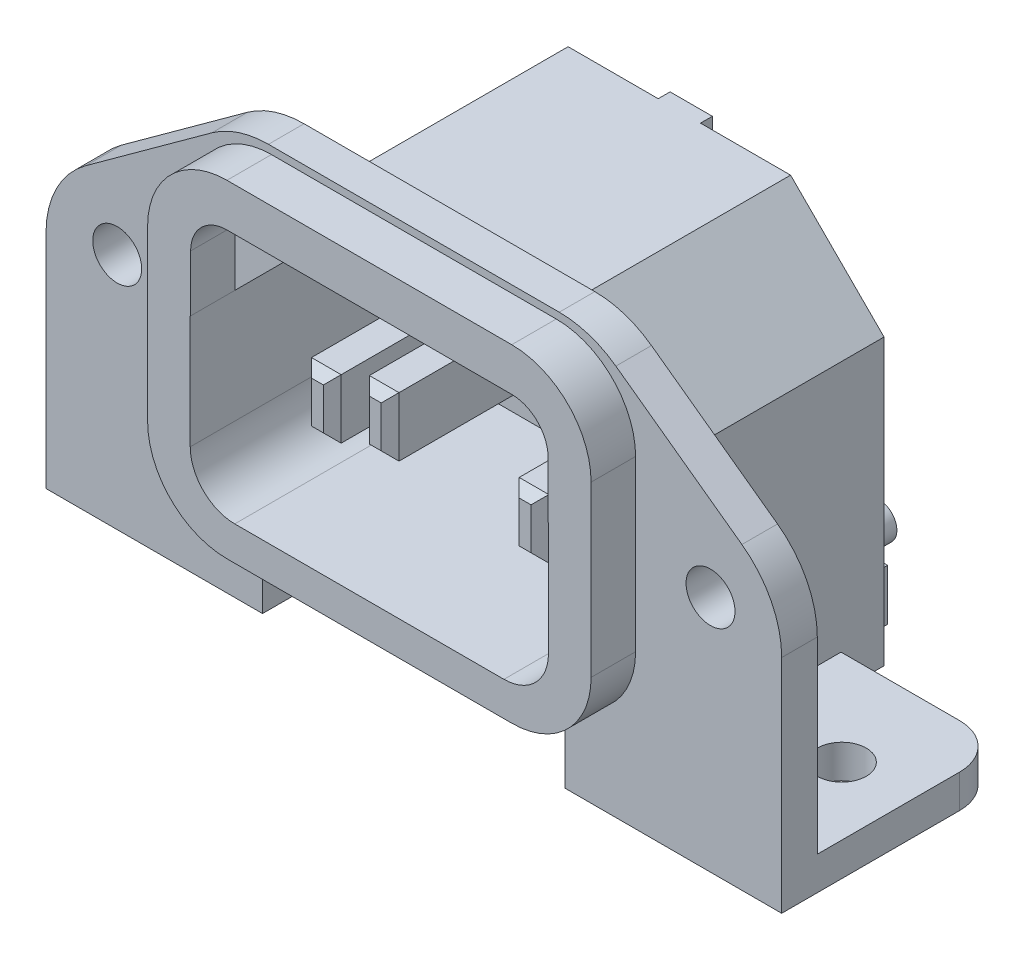
from build123d import *

# Parameters (mm, degrees)
SKETCH1_R                = 1.65
BOSS_EXTRUDE1_DEPTH      = 2.4
BOSS_EXTRUDE2_START      = 2.4
BOSS_EXTRUDE2_DEPTH      = 3
BOSS_EXTRUDE3_DEPTH      = 15.5
BOSS_EXTRUDE3_DEPTH_BACK = 2.4
CUT_EXTRUDE1_START       = -5
CUT_EXTRUDE1_DEPTH       = 25.5
BOSS_EXTRUDE4_DEPTH      = 2.4
SKETCH6_R                = 1.65
BOSS_EXTRUDE5_DEPTH      = 2.25
SKETCH7_W                = 20.4
SKETCH7_H                = 4
CUT_EXTRUDE2_DEPTH       = 16
SKETCH8_R                = 1.25
SKETCH8_W                = 1.5
SKETCH8_H                = 3
BOSS_EXTRUDE6_DEPTH      = 0.8
SKETCH9_R                = 1.2
SKETCH9_W                = 1.8
SKETCH9_H                = 3.45
BOSS_EXTRUDE10_DEPTH     = 2.54
SKETCH10_W               = 2.7
SKETCH10_H               = 2.7
SKETCH10_W_2             = 3.3
CUT_EXTRUDE3_DEPTH       = 1.9
BOSS_EXTRUDE11_DEPTH     = 0.1
SKETCH12_W               = 0.25
SKETCH12_H               = 1
SKETCH12_W_2             = 2
SKETCH12_H_2             = 0.25
SKETCH12_W_3             = 1.327638571
SKETCH12_W_4             = 0.371878528
EXTRUDE_THIN1_DEPTH      = 0.1
SKETCH13_W               = 2
SKETCH13_H               = 4
BOSS_EXTRUDE12_DEPTH     = 15.5
SKETCH13_3_W             = 2
SKETCH13_3_H             = 4
BOSS_EXTRUDE13_DEPTH     = 12.4
CHAMFER1_SIZE            = 0.6


with BuildPart() as part:
    # Sketch1 → Boss-Extrude1 (new body)
    with BuildSketch(Plane.XY):
        with BuildLine():
            Line((-22.117938133, 6.393107876), (-13.620132412, 12.560546399))
            ThreePointArc((-13.620132412, 12.560546399), (-11.809237927, 13.482376226), (-9.802194279, 13.8))
            Line((-9.802194279, 13.8), (9.802194279, 13.8))
            ThreePointArc((9.802194279, 13.8), (11.809237927, 13.482376226), (13.620132412, 12.560546399))
            Line((13.620132412, 12.560546399), (22.117938133, 6.393107876))
            ThreePointArc((22.117938133, 6.393107876), (24.090794326, 4.084967457), (24.8, 1.132561478))
            Line((24.8, 1.132561478), (24.8, -13.8))
            Line((24.8, -13.8), (10.15, -13.8))
            Line((10.15, -13.8), (10.15, -10.05))
            Line((10.15, -10.05), (-10.15, -10.05))
            Line((-10.15, -10.05), (-10.15, -13.8))
            Line((-10.15, -13.8), (-24.8, -13.8))
            Line((-24.8, -13.8), (-24.8, 1.132561478))
            ThreePointArc((-24.8, 1.132561478), (-24.090794326, 4.084967457), (-22.117938133, 6.393107876))
        make_face()
        with Locations((-20, 2.25)):
            Circle(SKETCH1_R, mode=Mode.SUBTRACT)
        with Locations((20, 2.25)):
            Circle(SKETCH1_R, mode=Mode.SUBTRACT)
        with BuildLine():
            Line((-12.05, 7.95), (-12.05, -3.45))
            ThreePointArc((-12.05, -3.45), (-11.332411614, -5.182411614), (-9.6, -5.9))
            Line((-9.6, -5.9), (9.6, -5.9))
            ThreePointArc((9.6, -5.9), (11.332411614, -5.182411614), (12.05, -3.45))
            Line((12.05, -3.45), (12.05, 7.95))
            ThreePointArc((12.05, 7.95), (11.332411614, 9.682411614), (9.6, 10.4))
            Line((9.6, 10.4), (-9.6, 10.4))
            ThreePointArc((-9.6, 10.4), (-11.332411614, 9.682411614), (-12.05, 7.95))
        make_face(mode=Mode.SUBTRACT)
    extrude(amount=BOSS_EXTRUDE1_DEPTH)

    # Sketch1<3> → Boss-Extrude2 (add)
    with BuildSketch(Plane.XY.offset(BOSS_EXTRUDE2_START)):
        with BuildLine():
            Line((9.6, 13.3), (-9.6, 13.3))
            ThreePointArc((-9.6, 13.3), (-13.383021279, 11.733021279), (-14.95, 7.95))
            Line((-14.95, 7.95), (-14.95, -3.45))
            ThreePointArc((-14.95, -3.45), (-13.383021279, -7.233021279), (-9.6, -8.8))
            Line((-9.6, -8.8), (9.6, -8.8))
            ThreePointArc((9.6, -8.8), (13.383021279, -7.233021279), (14.95, -3.45))
            Line((14.95, -3.45), (14.95, 7.95))
            ThreePointArc((14.95, 7.95), (13.383021279, 11.733021279), (9.6, 13.3))
        make_face()
        with BuildLine():
            Line((-12.05, -3.45), (-12.05, 7.95))
            ThreePointArc((-12.05, 7.95), (-11.332411614, 9.682411614), (-9.6, 10.4))
            Line((-9.6, 10.4), (9.6, 10.4))
            ThreePointArc((9.6, 10.4), (11.332411614, 9.682411614), (12.05, 7.95))
            Line((12.05, 7.95), (12.05, -3.45))
            ThreePointArc((12.05, -3.45), (11.332411614, -5.182411614), (9.6, -5.9))
            Line((9.6, -5.9), (-9.6, -5.9))
            ThreePointArc((-9.6, -5.9), (-11.332411614, -5.182411614), (-12.05, -3.45))
        make_face(mode=Mode.SUBTRACT)
    extrude(amount=BOSS_EXTRUDE2_DEPTH)

    # Sketch2 → Boss-Extrude3 (add, two sides: drawn at the far end of the back side and taken through both)
    with BuildSketch(Plane(origin=(0, 0, 0), x_dir=(-1, 0, 0), z_dir=(0, 0, -1)).offset(-BOSS_EXTRUDE3_DEPTH_BACK)):
        Polygon((-7.5, 11.7), (7.5, 11.7), (13.8, 5.4), (13.8, -13.8), (-13.8, -13.8), (-13.8, 5.4), align=None)
    extrude(amount=BOSS_EXTRUDE3_DEPTH + BOSS_EXTRUDE3_DEPTH_BACK)

    # Sketch4 → Cut-Extrude1 (cut)
    with BuildSketch(Plane(origin=(0, 0, -15.5), x_dir=(-1, 0, 0), z_dir=(0, 0, -1)).offset(CUT_EXTRUDE1_START)):
        with BuildLine():
            Line((12.075, -3.5), (12.075, 4.131013716))
            Line((12.075, 4.131013716), (6.206013716, 10))
            Line((6.206013716, 10), (-6.206013716, 10))
            Line((-6.206013716, 10), (-12.075, 4.131013716))
            Line((-12.075, 4.131013716), (-12.075, -3.5))
            ThreePointArc((-12.075, -3.5), (-11.196320344, -5.621320344), (-9.075, -6.5))
            Line((-9.075, -6.5), (9.075, -6.5))
            ThreePointArc((9.075, -6.5), (11.196320344, -5.621320344), (12.075, -3.5))
        make_face()
    extrude(amount=-CUT_EXTRUDE1_DEPTH, mode=Mode.SUBTRACT)

    # Sketch3 → Boss-Extrude4 (add)
    with BuildSketch(Plane.XY.offset(2.4)):
        with BuildLine():
            Line((-12.05, 7.15), (-8.8, 10.4))
            ThreePointArc((-8.8, 10.4), (-11.518709718, 9.868709718), (-12.05, 7.15))
        make_face()
        with BuildLine():
            Line((12.05, 7.15), (8.8, 10.4))
            ThreePointArc((8.8, 10.4), (11.518709718, 9.868709718), (12.05, 7.15))
        make_face()
    extrude(amount=-BOSS_EXTRUDE4_DEPTH)

    # Sketch6 → Boss-Extrude5 (add)
    # profile 1 of 2: a face of its own
    with BuildSketch(Plane.XZ.offset(13.8)):
        with BuildLine():
            Line((-24.8, 0), (-24.8, -9.6))
            ThreePointArc((-24.8, -9.6), (-23.921320344, -11.721320344), (-21.8, -12.6))
            Line((-21.8, -12.6), (-13.8, -12.6))
            Line((-13.8, -12.6), (-13.8, 0))
            Line((-13.8, 0), (-24.8, 0))
        make_face()
        with Locations(Location((-20.25, -6.2, 0), (0, 0, 270))):
            Circle(SKETCH6_R, mode=Mode.SUBTRACT)
    # profile 2 of 2: a face of its own
    with BuildSketch(Plane.XZ.offset(13.8)):
        with BuildLine():
            Line((24.8, 0), (13.8, 0))
            Line((13.8, 0), (13.8, -12.6))
            Line((13.8, -12.6), (21.8, -12.6))
            ThreePointArc((21.8, -12.6), (23.921320344, -11.721320344), (24.8, -9.6))
            Line((24.8, -9.6), (24.8, 0))
        make_face()
        with Locations(Location((20.25, -6.2, 0), (0, 0, 90))):
            Circle(SKETCH6_R, mode=Mode.SUBTRACT)
    extrude(amount=-BOSS_EXTRUDE5_DEPTH)

    # Sketch7 → Cut-Extrude2 (cut)
    with BuildSketch(Plane.XY.offset(2.4)):
        with Locations((0, -11.8)):
            Rectangle(SKETCH7_W, SKETCH7_H)
    extrude(amount=-CUT_EXTRUDE2_DEPTH, mode=Mode.SUBTRACT)

    # Sketch8 → Boss-Extrude6 (add)
    # profile 1 of 3: a face of its own
    with BuildSketch(Plane(origin=(0, 0, -15.5), x_dir=(-1, 0, 0), z_dir=(0, 0, -1))):
        with BuildLine():
            Line((-1.425, 11.7), (-1.425, 6.3))
            ThreePointArc((-1.425, 6.3), (-2.519560189, 5.015284845), (-2.647588151, 3.332381437))
            Line((-2.647588151, 3.332381437), (-1.3, -2.2))
            Line((-1.3, -2.2), (-1.3, -10.1))
            Line((-1.3, -10.1), (-0.65, -14.85))
            Line((-0.65, -14.85), (-0.65, -17.85))
            Line((-0.65, -17.85), (0.65, -17.85))
            Line((0.65, -17.85), (0.65, -14.85))
            Line((0.65, -14.85), (1.3, -10.1))
            Line((1.3, -10.1), (1.3, -2.2))
            Line((1.3, -2.2), (2.647588151, 3.332381437))
            ThreePointArc((2.647588151, 3.332381437), (2.519560189, 5.015284845), (1.425, 6.3))
            Line((1.425, 6.3), (1.425, 11.7))
            Line((1.425, 11.7), (-1.425, 11.7))
        make_face()
        with Locations((0, 3.97728607)):
            Circle(SKETCH8_R, mode=Mode.SUBTRACT)
        with Locations((0, 8.7)):
            Rectangle(SKETCH8_W, SKETCH8_H, mode=Mode.SUBTRACT)
    # profile 2 of 3: a face of its own
    with BuildSketch(Plane(origin=(0, 0, -15.5), x_dir=(-1, 0, 0), z_dir=(0, 0, -1))):
        with BuildLine():
            Line((4.447034739, -1.145156182), (6.9, -4.55))
            Line((6.9, -4.55), (6.9, -9.55))
            Line((6.9, -9.55), (8.4, -12.35))
            Line((8.4, -12.35), (8.4, -17.85))
            Line((8.4, -17.85), (9.7, -17.85))
            Line((9.7, -17.85), (9.7, -12.35))
            Line((9.7, -12.35), (9.7, -9.55))
            Line((9.7, -9.55), (9.7, -4.55))
            Line((9.7, -4.55), (9.7, 0.55))
            ThreePointArc((9.7, 0.55), (5.909382028, 3.309855001), (4.447034739, -1.145156182))
        make_face()
        with Locations(Location((6.8, 0.55, 0), (0, 0, 180))):
            Circle(SKETCH8_R, mode=Mode.SUBTRACT)
    # profile 3 of 3: a face of its own
    with BuildSketch(Plane(origin=(0, 0, -15.5), x_dir=(-1, 0, 0), z_dir=(0, 0, -1))):
        with BuildLine():
            Line((-9.7, 0.55), (-9.7, -4.55))
            Line((-9.7, -4.55), (-9.7, -9.55))
            Line((-9.7, -9.55), (-9.7, -12.35))
            Line((-9.7, -12.35), (-9.7, -17.85))
            Line((-9.7, -17.85), (-8.4, -17.85))
            Line((-8.4, -17.85), (-8.4, -12.35))
            Line((-8.4, -12.35), (-6.9, -9.55))
            Line((-6.9, -9.55), (-6.9, -4.55))
            Line((-6.9, -4.55), (-4.447034739, -1.145156182))
            ThreePointArc((-4.447034739, -1.145156182), (-5.909382028, 3.309855001), (-9.7, 0.55))
        make_face()
        with Locations((-6.8, 0.55)):
            Circle(SKETCH8_R, mode=Mode.SUBTRACT)
    extrude(amount=BOSS_EXTRUDE6_DEPTH)

    # Sketch9 → Boss-Extrude10 (add)
    with BuildSketch(Plane(origin=(0, 0, -15.5), x_dir=(-1, 0, 0), z_dir=(0, 0, -1))):
        with Locations((5.675, -8)):
            Circle(SKETCH9_R)
        with Locations((10.925, -8)):
            Circle(SKETCH9_R)
        with Locations(Location((-10.925, -8, 0), (0, 0, 180))):
            Circle(SKETCH9_R)
        with Locations(Location((-5.675, -8, 0), (0, 0, 180))):
            Circle(SKETCH9_R)
        with BuildLine():
            Line((-4.976841486, 5.92292498), (-2.917879907, -2.529925262))
            Line((-2.917879907, -2.529925262), (-2.917879907, -7.6))
            ThreePointArc((-2.917879907, -7.6), (-3.017879907, -8), (-2.917879907, -8.4))
            Line((-2.917879907, -8.4), (-2.917879907, -13.8))
            Line((-2.917879907, -13.8), (-1.417879907, -13.8))
            Line((-1.417879907, -13.8), (-1.417879907, -8.4))
            ThreePointArc((-1.417879907, -8.4), (-1.317879907, -8), (-1.417879907, -7.6))
            Line((-1.417879907, -7.6), (-1.417879907, -2.349871083))
            Line((-1.417879907, -2.349871083), (-3.519453514, 6.277918356))
            Line((-3.519453514, 6.277918356), (-4.976841486, 5.92292498))
        make_face()
        with BuildLine():
            Line((1.417879907, -2.349871083), (3.519453514, 6.277918356))
            Line((3.519453514, 6.277918356), (4.976841486, 5.92292498))
            Line((4.976841486, 5.92292498), (2.917879907, -2.529925262))
            Line((2.917879907, -2.529925262), (2.917879907, -7.6))
            ThreePointArc((2.917879907, -7.6), (3.017879907, -8), (2.917879907, -8.4))
            Line((2.917879907, -8.4), (2.917879907, -13.8))
            Line((2.917879907, -13.8), (1.417879907, -13.8))
            Line((1.417879907, -13.8), (1.417879907, -8.4))
            ThreePointArc((1.417879907, -8.4), (1.317879907, -8), (1.417879907, -7.6))
            Line((1.417879907, -7.6), (1.417879907, -2.349871083))
        make_face()
        with Locations((10.6, -12.075)):
            Rectangle(SKETCH9_W, SKETCH9_H)
        with Locations((-10.6, -12.075)):
            Rectangle(SKETCH9_W, SKETCH9_H)
    extrude(amount=BOSS_EXTRUDE10_DEPTH)

    # Sketch10 → Cut-Extrude3 (cut)
    with BuildSketch(Plane.XY.offset(-13.6)):
        with Locations((7.25, -12.45)):
            Rectangle(SKETCH10_W, SKETCH10_H)
        with Locations((0, -12.45)):
            Rectangle(SKETCH10_W_2, SKETCH10_H)
        with Locations((-7.25, -12.45)):
            Rectangle(SKETCH10_W, SKETCH10_H)
    extrude(amount=-CUT_EXTRUDE3_DEPTH, mode=Mode.SUBTRACT)

    # Sketch11 → Boss-Extrude11 (add)
    with BuildSketch(Plane(origin=(0, 0, -15.5), x_dir=(-1, 0, 0), z_dir=(0, 0, -1))):
        Polygon((-11.869230769, -3.55), (-11.545913462, -3.55), (-10.638461538, -4.866105769), (-10.638461538, -3.55), (-10.279487179, -3.55), (-10.279487179, -5.55), (-10.605208333, -5.55), (-11.51025641, -4.237900641), (-11.51025641, -5.55), (-11.869230769, -5.55), align=None)
        Polygon((10.571750072, -3.55), (11.135852636, -3.55), (11.135852636, -5.191025641), (11.956365456, -5.191025641), (11.956365456, -5.55), (10.571750072, -5.55), align=None)
    extrude(amount=BOSS_EXTRUDE11_DEPTH)

    # Sketch12 → Extrude-Thin1 (add)
    with BuildSketch(Plane(origin=(0, 0, -15.5), x_dir=(-1, 0, 0), z_dir=(0, 0, -1))):
        with Locations((5.286651735, 10.584637253)):
            Rectangle(SKETCH12_W, SKETCH12_H)
        with Locations((5.286651735, 10.084637253)):
            Rectangle(SKETCH12_W_2, SKETCH12_H_2)
        with Locations((5.286651735, 9.484637253)):
            Rectangle(SKETCH12_W_3, SKETCH12_H_2)
        with Locations((5.286651735, 8.884637253)):
            Rectangle(SKETCH12_W_4, SKETCH12_H_2)
    extrude(amount=EXTRUDE_THIN1_DEPTH)

    # Sketch13 → Boss-Extrude12 (add)
    with BuildSketch(Plane.XY.offset(-10.5)):
        with Locations((0, 3.7)):
            Rectangle(SKETCH13_W, SKETCH13_H)
    extrude(amount=BOSS_EXTRUDE12_DEPTH)

    # Sketch13<3> → Boss-Extrude13 (add)
    with BuildSketch(Plane.XY.offset(-10.5)):
        with Locations((-7, -0.3)):
            Rectangle(SKETCH13_3_W, SKETCH13_3_H)
        with Locations((7, -0.3)):
            Rectangle(SKETCH13_3_W, SKETCH13_3_H)
    extrude(amount=BOSS_EXTRUDE13_DEPTH)

    # Chamfer1
    chamfer1_edges = [part.edges().sort_by_distance(p)[0] for p in [
        (1, 3.7, 5),
        (0, 5.7, 5),
        (-1, 3.7, 5),
        (0, 1.7, 5),
        (-6, -0.3, 1.9),
        (-7, 1.7, 1.9),
        (-8, -0.3, 1.9),
        (-7, -2.3, 1.9),
        (8, -0.3, 1.9),
        (7, -2.3, 1.9),
        (7, 1.7, 1.9),
        (6, -0.3, 1.9),
    ]]
    chamfer(chamfer1_edges, length=CHAMFER1_SIZE)


solid = part.part
